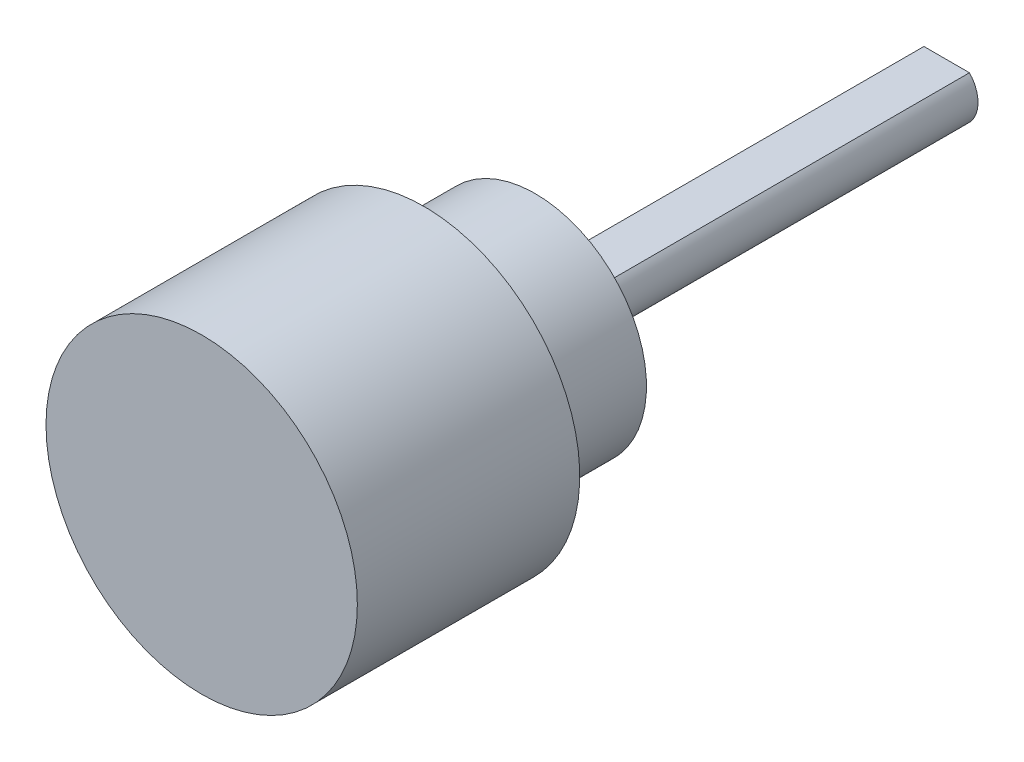
from build123d import *

# Parameters (mm, degrees)
ESQUISSE1_R             = 14
BOSS_EXTRU_1_DEPTH      = 20
BOSS_EXTRU_2_DEPTH      = 47
ESQUISSE3_R             = 18
BOSS_EXTRU_3_DEPTH      = 2
ESQUISSE4_R             = 10
BOSS_EXTRU_4_DEPTH      = 8
BOSS_EXTRU_5_START      = -2
BOSS_EXTRU_5_DEPTH      = 2
ENL_V_START             = -2
ESQUISSE6_R             = 10
ENL_V_MAT_EXTRU_1_DEPTH = 2


with BuildPart() as part:
    # Esquisse1 → Boss.-Extru.1 (new body)
    with BuildSketch(Plane.XY):
        Circle(ESQUISSE1_R)
    extrude(amount=BOSS_EXTRU_1_DEPTH)

    # Esquisse2 → Boss.-Extru.2 (add)
    with BuildSketch(Plane(origin=(0, 0, 0), x_dir=(-1, 0, 0), z_dir=(0, 0, -1))):
        with BuildLine():
            Line((-2.047747609, 1.933319394), (2.047747609, 1.933319394))
            ThreePointArc((2.047747609, 1.933319394), (0, -2.816202079), (-2.047747609, 1.933319394))
        make_face()
    extrude(amount=BOSS_EXTRU_2_DEPTH)

    # Esquisse3 → Boss.-Extru.3 (add)
    with BuildSketch(Plane(origin=(0, 0, 0), x_dir=(-1, 0, 0), z_dir=(0, 0, -1))):
        Circle(ESQUISSE3_R)
    extrude(amount=BOSS_EXTRU_3_DEPTH)

    # Esquisse4 → Boss.-Extru.4 (add)
    with BuildSketch(Plane(origin=(0, 0, -2), x_dir=(-1, 0, 0), z_dir=(0, 0, -1))):
        Circle(ESQUISSE4_R)
    extrude(amount=BOSS_EXTRU_4_DEPTH)

    # Esquisse5 → Boss.-Extru.5 (add)
    with BuildSketch(Plane(origin=(0, 0, -2), x_dir=(-1, 0, 0), z_dir=(0, 0, -1)).offset(BOSS_EXTRU_5_START)):
        with BuildLine():
            Line((50, 18), (0, 18))
            ThreePointArc((0, 18), (12.727922061, 12.727922061), (18, 0))
            ThreePointArc((18, 0), (12.727922061, -12.727922061), (0, -18))
            Line((0, -18), (50, -18))
            ThreePointArc((50, -18), (57.071067812, -15.071067812), (60, -8))
            Line((60, -8), (60, 8))
            ThreePointArc((60, 8), (57.071067812, 15.071067812), (50, 18))
        make_face()
    extrude(amount=BOSS_EXTRU_5_DEPTH)

    # Esquisse6 → Enlèv. mat.-Extru.1 (cut)
    with BuildSketch(Plane(origin=(0, 0, -2), x_dir=(-1, 0, 0), z_dir=(0, 0, -1)).offset(ENL_V_START)):
        Polygon((0, 18), (-22.504594186, 18), (-22.504594186, -18), (62.101973599, -18), (62.101973599, 18), align=None)
        Circle(ESQUISSE6_R, mode=Mode.SUBTRACT)
    extrude(amount=ENL_V_MAT_EXTRU_1_DEPTH, mode=Mode.SUBTRACT)


solid = part.part
